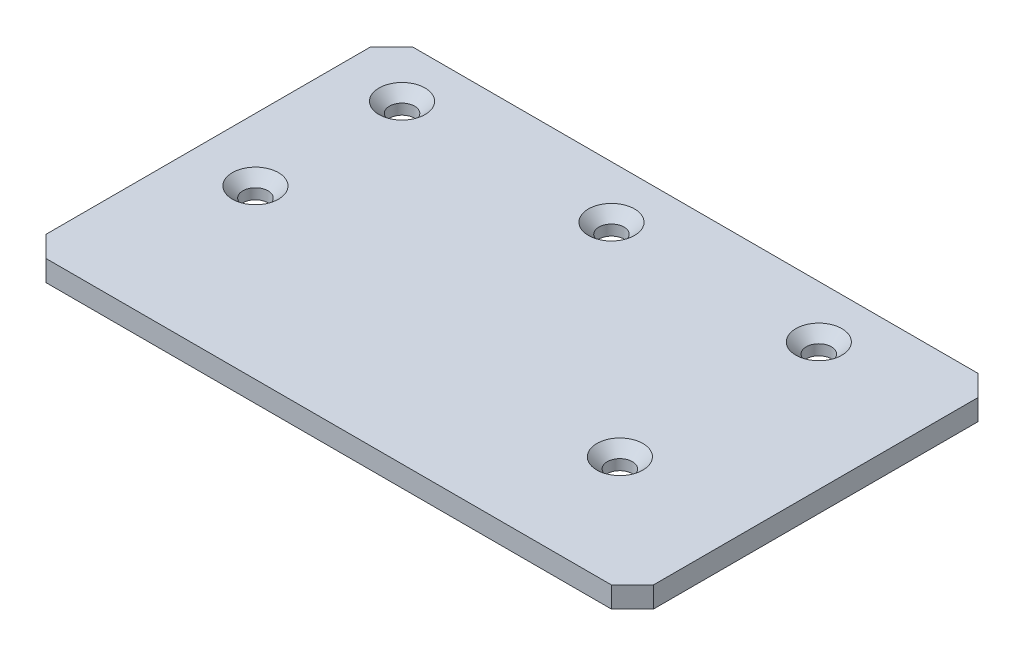
from build123d import *

# Parameters (mm, degrees)
SKETCH1_W                                    = 58
SKETCH1_H                                    = 35
BOSS_EXTRUDE1_DEPTH                          = 2
CSK_FOR_ST2_2_CROSS_RECESSED_CTSK_HE_2_COUNT = 2
CSK_FOR_ST2_2_CROSS_RECESSED_CTSK_HE_2_PITCH = 20
CSK_FOR_ST2_2_CROSS_RECESSED_CTSK_HE_3_COUNT = 2
CSK_FOR_ST2_2_CROSS_RECESSED_CTSK_HE_3_PITCH = 39.8
CSK_FOR_ST2_2_CROSS_RECESSED_CTSK_HE_4_COUNT = 2
CSK_FOR_ST2_2_CROSS_RECESSED_CTSK_HE_4_PITCH = 44.102607633
CSK_FOR_ST2_2_CROSS_RECESSED_CTSK_HE_5_COUNT = 2
CSK_FOR_ST2_2_CROSS_RECESSED_CTSK_HE_5_PITCH = 14
CHAMFER1_SIZE                                = 2


with BuildPart() as part:
    # Sketch1 → Boss-Extrude1 (new body)
    with BuildSketch(Plane(origin=(0, 0, 0), x_dir=(1, 0, 0), z_dir=(0, 1, 0))):
        Rectangle(SKETCH1_W, SKETCH1_H)
    extrude(amount=BOSS_EXTRUDE1_DEPTH)

    # Sketch3 → CSK for ST2.2 Cross recessed CTSK head tapping screws1 (revolve, cut)
    with BuildSketch(Plane(origin=(-23, 2, -12.5), x_dir=(0, 0, 1), z_dir=(1, 0, 0))):
        Polygon((0, 0), (0, 2), (1.2, 2), (1.2, 1), (2.2, 0), align=None)
    csk_for_st2_2_cross_recessed_ctsk_head_t = revolve(axis=Axis((-23, 8.35, -12.5), (0, -1, 0)), mode=Mode.SUBTRACT)

    # CSK for ST2.2 Cross recessed CTSK he 2: CSK for ST2.2 Cross recessed CTSK head tapping screws1 ×2
    with Locations(*[(i * CSK_FOR_ST2_2_CROSS_RECESSED_CTSK_HE_2_PITCH, 0, 0) for i in range(1, CSK_FOR_ST2_2_CROSS_RECESSED_CTSK_HE_2_COUNT)]):
        add(csk_for_st2_2_cross_recessed_ctsk_head_t, mode=Mode.SUBTRACT)

    # CSK for ST2.2 Cross recessed CTSK he 3: CSK for ST2.2 Cross recessed CTSK head tapping screws1 ×2
    with Locations(*[(i * CSK_FOR_ST2_2_CROSS_RECESSED_CTSK_HE_3_PITCH, 0, 0) for i in range(1, CSK_FOR_ST2_2_CROSS_RECESSED_CTSK_HE_3_COUNT)]):
        add(csk_for_st2_2_cross_recessed_ctsk_head_t, mode=Mode.SUBTRACT)

    # CSK for ST2.2 Cross recessed CTSK he 4: CSK for ST2.2 Cross recessed CTSK head tapping screws1 ×2
    with Locations(*[Vector(0.9024409697382602, 0, 0.4308135282670086) * (i * CSK_FOR_ST2_2_CROSS_RECESSED_CTSK_HE_4_PITCH) for i in range(1, CSK_FOR_ST2_2_CROSS_RECESSED_CTSK_HE_4_COUNT)]):
        add(csk_for_st2_2_cross_recessed_ctsk_head_t, mode=Mode.SUBTRACT)

    # CSK for ST2.2 Cross recessed CTSK he 5: CSK for ST2.2 Cross recessed CTSK head tapping screws1 ×2
    with Locations(*[(0, 0, i * CSK_FOR_ST2_2_CROSS_RECESSED_CTSK_HE_5_PITCH) for i in range(1, CSK_FOR_ST2_2_CROSS_RECESSED_CTSK_HE_5_COUNT)]):
        add(csk_for_st2_2_cross_recessed_ctsk_head_t, mode=Mode.SUBTRACT)

    # Chamfer1
    chamfer1_edges = [part.edges().sort_by_distance(p)[0] for p in [
        (29, 1, 17.5),
        (-29, 1, 17.5),
        (-29, 1, -17.5),
        (29, 1, -17.5),
    ]]
    chamfer(chamfer1_edges, length=CHAMFER1_SIZE)


solid = part.part
